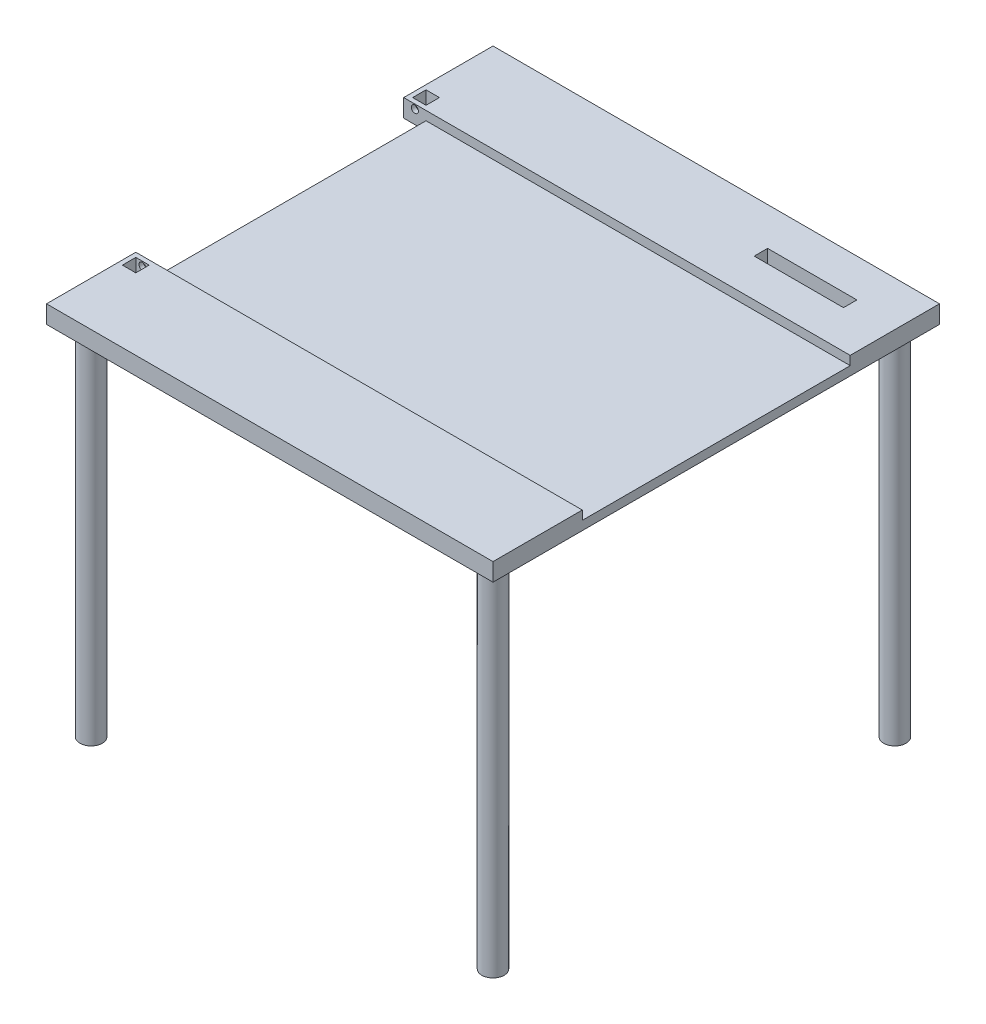
from build123d import *

# Parameters (mm, degrees)
SKETCH1_W           = 1000
SKETCH1_H           = 1000
BOSS_EXTRUDE1_DEPTH = 40
SKETCH2_W           = 1000
SKETCH2_H           = 600
CUT_EXTRUDE1_DEPTH  = 20
SKETCH6_R           = 25
BOSS_EXTRUDE8_DEPTH = 800
SKETCH7_W           = 30
SKETCH7_H           = 30
CUT_EXTRUDE3_DEPTH  = 50
SKETCH8_R           = 8
CUT_EXTRUDE4_DEPTH  = 30
CUT_EXTRUDE5_START  = -30
SKETCH9_R           = 8
CUT_EXTRUDE5_DEPTH  = 30
SKETCH10_W          = 50
SKETCH10_H          = 600
CUT_EXTRUDE6_DEPTH  = 30
CUT_EXTRUDE7_DEPTH  = 30


with BuildPart() as part:
    # Sketch1 → Boss-Extrude1 (new body)
    with BuildSketch(Plane(origin=(0, 0, 0), x_dir=(1, 0, 0), z_dir=(0, 1, 0))):
        with Locations((500, -500)):
            Rectangle(SKETCH1_W, SKETCH1_H)
    extrude(amount=BOSS_EXTRUDE1_DEPTH)

    # Sketch2 → Cut-Extrude1 (cut)
    with BuildSketch(Plane(origin=(0, 40, 0), x_dir=(1, 0, 0), z_dir=(0, 1, 0))):
        with Locations((500, -500)):
            Rectangle(SKETCH2_W, SKETCH2_H)
    extrude(amount=-CUT_EXTRUDE1_DEPTH, mode=Mode.SUBTRACT)

    # Sketch6 → Boss-Extrude8 (add)
    with BuildSketch(Plane(origin=(0, 0, 0), x_dir=(-1, 0, 0), z_dir=(0, -1, 0))):
        with Locations(Location((-50, -950, 0), (0, 0, 90))):
            Circle(SKETCH6_R)
        with Locations(Location((-950, -950, 0), (0, 0, 90))):
            Circle(SKETCH6_R)
        with Locations(Location((-950, -50, 0), (0, 0, 90))):
            Circle(SKETCH6_R)
        with Locations(Location((-50, -50, 0), (0, 0, 90))):
            Circle(SKETCH6_R)
    extrude(amount=BOSS_EXTRUDE8_DEPTH)

    # Sketch7 → Cut-Extrude3 (cut)
    with BuildSketch(Plane(origin=(0, 40, 0), x_dir=(1, 0, 0), z_dir=(0, 1, 0))):
        with Locations((25, -175)):
            Rectangle(SKETCH7_W, SKETCH7_H)
        with Locations((25, -825)):
            Rectangle(SKETCH7_W, SKETCH7_H)
    extrude(amount=-CUT_EXTRUDE3_DEPTH, mode=Mode.SUBTRACT)

    # Sketch8 → Cut-Extrude4 (cut)
    with BuildSketch(Plane.XY.offset(200)):
        with Locations((25, 30)):
            Circle(SKETCH8_R)
    extrude(amount=-CUT_EXTRUDE4_DEPTH, mode=Mode.SUBTRACT)

    # Sketch9 → Cut-Extrude5 (cut)
    with BuildSketch(Plane(origin=(0, 0, 800), x_dir=(-1, 0, 0), z_dir=(0, 0, -1)).offset(CUT_EXTRUDE5_START)):
        with Locations(Location((-25, 30, 0), (0, 0, 180))):
            Circle(SKETCH9_R)
    extrude(amount=CUT_EXTRUDE5_DEPTH, mode=Mode.SUBTRACT)

    # Sketch10 → Cut-Extrude6 (cut)
    with BuildSketch(Plane(origin=(0, 20, 0), x_dir=(1, 0, 0), z_dir=(0, 1, 0))):
        with Locations((25, -500)):
            Rectangle(SKETCH10_W, SKETCH10_H)
    extrude(amount=-CUT_EXTRUDE6_DEPTH, mode=Mode.SUBTRACT)

    # Sketch11 → Cut-Extrude7 (cut)
    with BuildSketch(Plane(origin=(0, 40, 0), x_dir=(1, 0, 0), z_dir=(0, 1, 0))):
        Polygon((700, -115), (900, -115), (900, -100), (900, -85), (700, -85), align=None)
    extrude(amount=-CUT_EXTRUDE7_DEPTH, mode=Mode.SUBTRACT)


solid = part.part
